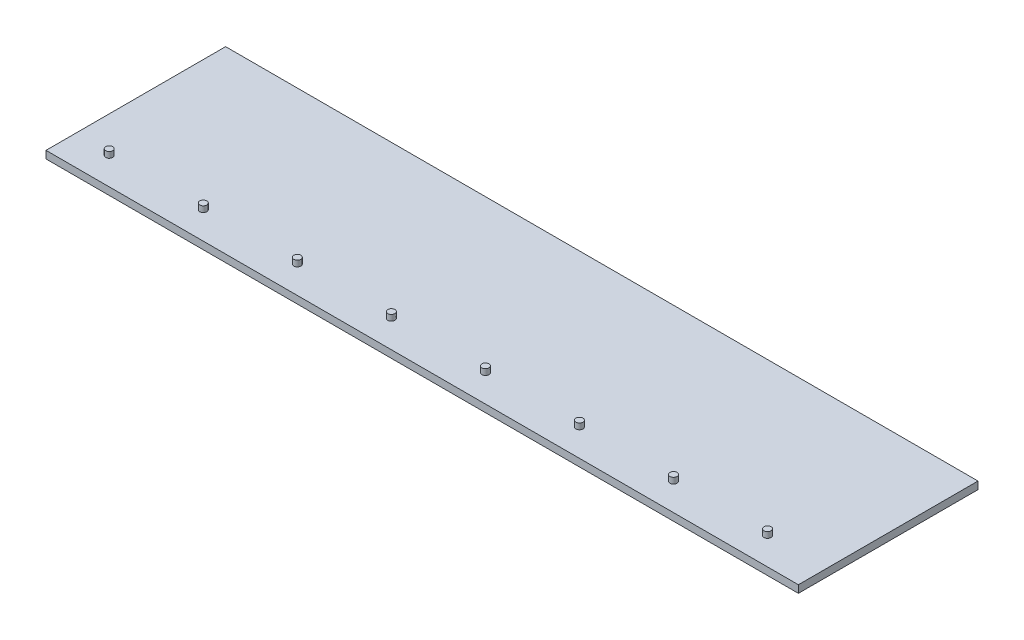
from build123d import *

# Parameters (mm, degrees)
SKETCH1_W           = 159.592906802
SKETCH1_H           = 38.1
BOSS_EXTRUDE1_DEPTH = 1.5875
SKETCH2_R           = 0.75
BOSS_EXTRUDE2_DEPTH = 1.2446
LPATTERN1_COUNT     = 8
LPATTERN1_PITCH     = 19.94911335


with BuildPart() as part:
    # Sketch1 → Boss-Extrude1 (new body)
    with BuildSketch(Plane(origin=(0, 0, 0), x_dir=(1, 0, 0), z_dir=(0, 1, 0))):
        with Locations((79.796453401, 19.05)):
            Rectangle(SKETCH1_W, SKETCH1_H)
    extrude(amount=BOSS_EXTRUDE1_DEPTH)

    # Sketch2 → Boss-Extrude2 (add)
    with BuildSketch(Plane(origin=(0, 1.5875, 0), x_dir=(1, 0, 0), z_dir=(0, 1, 0))):
        with Locations(Location((7.640640269, 5.771220173, 0), (0, 0, 90))):
            Circle(SKETCH2_R)
    boss_extrude2 = extrude(amount=BOSS_EXTRUDE2_DEPTH)

    # LPattern1: Boss-Extrude2 ×8
    with Locations(*[(i * LPATTERN1_PITCH, 0, 0) for i in range(1, LPATTERN1_COUNT)]):
        add(boss_extrude2)


solid = part.part
